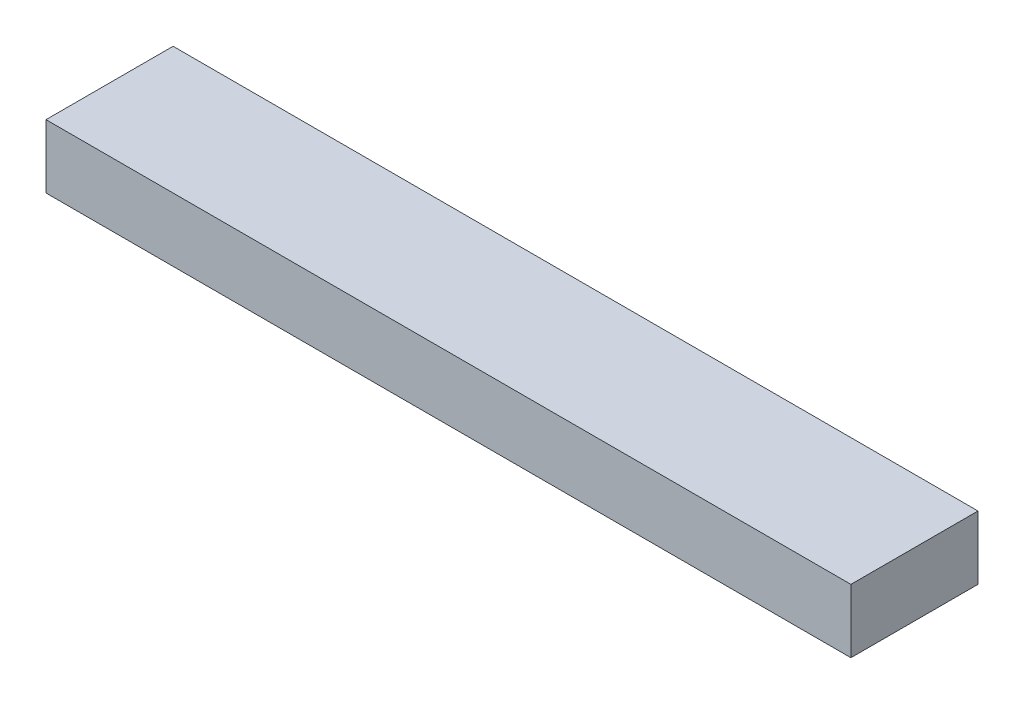
from build123d import *

# Parameters (mm, degrees)
ESQUISSE1_W        = 304
ESQUISSE1_H        = 48
BOSS_EXTRU_1_DEPTH = 24


with BuildPart() as part:
    # Esquisse1 → Boss.-Extru.1 (new body)
    with BuildSketch(Plane(origin=(0, 0, 0), x_dir=(1, 0, 0), z_dir=(0, 1, 0))):
        Rectangle(ESQUISSE1_W, ESQUISSE1_H)
    extrude(amount=BOSS_EXTRU_1_DEPTH)


solid = part.part
